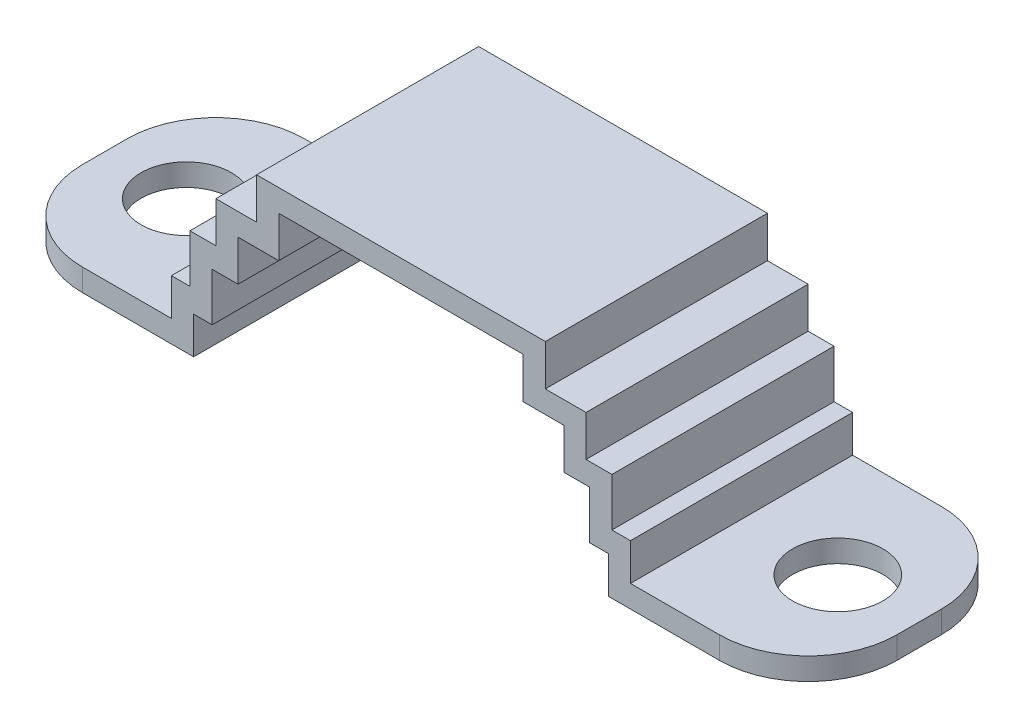
from build123d import *

# Parameters (mm, degrees)
EXTRUDE_THIN1_DEPTH  = 15
SKETCH2_R            = 6.1
CUT_EXTRUDE1_DEPTH   = 62.306626885
FILLET1_R            = 12
FILLET1_OF_MIRROR1_R = 12


with BuildPart() as part:
    # Sketch1 → Extrude-Thin1 (new, symmetric)
    with BuildSketch(Plane.XY):
        Polygon((-55, 4.5), (-28, 4.5), (-28, 9.5), (-25.5, 9.5), (-25.5, 16), (-22, 16), (-22, 21.5), (-16.5, 21.5), (-16.5, 27.05), (0, 27.05), (0, 30.05), (-19.5, 30.05), (-19.5, 24.5), (-25, 24.5), (-25, 19), (-28.5, 19), (-28.5, 12.5), (-31, 12.5), (-31, 7.5), (-55, 7.5), align=None)
    extrude_thin1 = extrude(amount=EXTRUDE_THIN1_DEPTH, both=True)

    # Sketch2 → Cut-Extrude1 (cut, through all)
    with BuildSketch(Plane(origin=(0, 7.5, 0), x_dir=(1, 0, 0), z_dir=(0, 1, 0))):
        with Locations(Location((-44, 0, 0), (0, 0, 270))):
            Circle(SKETCH2_R)
    cut_extrude1 = extrude(amount=-CUT_EXTRUDE1_DEPTH, mode=Mode.SUBTRACT)

    # Fillet1
    fillet1_edges = [part.edges().sort_by_distance(p)[0] for p in [
        (-55, 6, -15),
        (-55, 6, 15),
    ]]
    fillet(fillet1_edges, radius=FILLET1_R)

    # Mirror1: Extrude-Thin1, Cut-Extrude1 across plane
    add(extrude_thin1.mirror(Plane(origin=(0, 30.05, 15), x_dir=(0, 0, 1), z_dir=(1, 0, 0))))
    add(cut_extrude1.mirror(Plane(origin=(0, 30.05, 15), x_dir=(0, 0, 1), z_dir=(1, 0, 0))), mode=Mode.SUBTRACT)

    # Fillet1 of Mirror1
    fillet1_of_mirror1_edges = [part.edges().sort_by_distance(p)[0] for p in [
        (55, 6, -15),
        (55, 6, 15),
    ]]
    fillet(fillet1_of_mirror1_edges, radius=FILLET1_OF_MIRROR1_R)


solid = part.part
